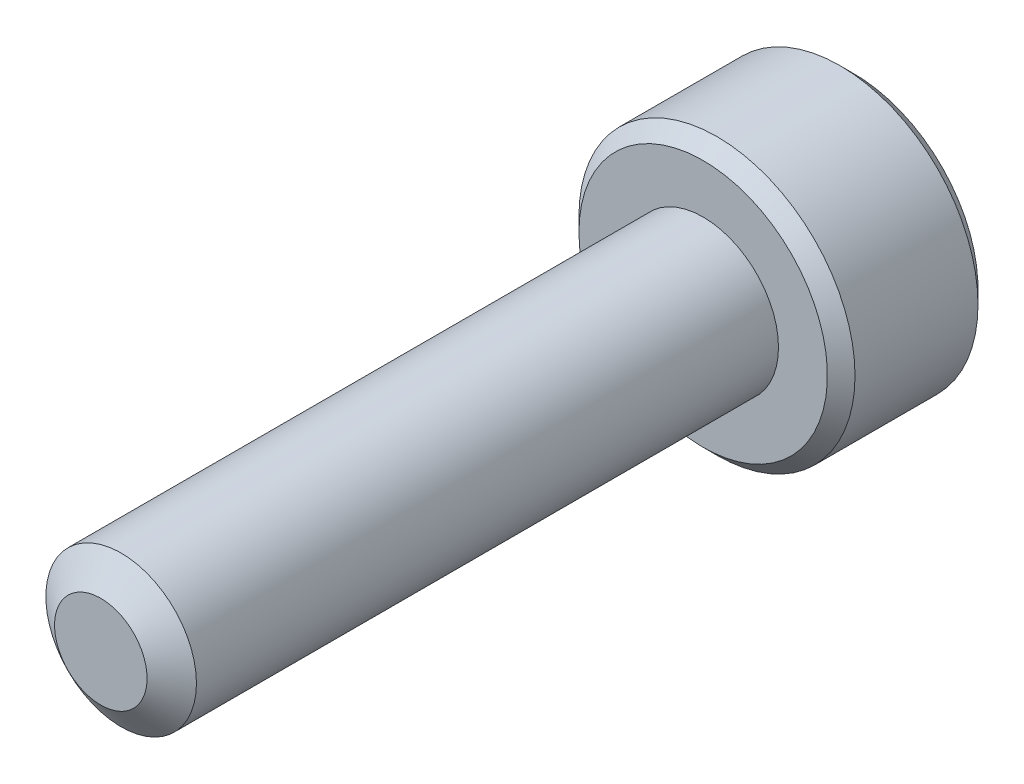
from build123d import *

# Parameters (mm, degrees)
SKETCH1_R          = 1.5
EXTRUDE1_DEPTH     = 12
SKETCH6_R          = 2.75
EXTRUDE2_DEPTH     = 3
CUT_EXTRUDE1_DEPTH = 1.875
CHAMFER1_SIZE      = 0.275


with BuildPart() as part:
    # Sketch1 → Extrude1 (new body)
    with BuildSketch(Plane.XY):
        Circle(SKETCH1_R)
    extrude(amount=-EXTRUDE1_DEPTH)

    # Sketch4 → Cut-Revolve1 (revolve, cut)
    with BuildSketch(Plane(origin=(0, 0, 0), x_dir=(0, 0, -1), z_dir=(1, 0, 0))):
        Polygon((0.405251783, 1.5), (0, 0.921240474), (0, 1.5), align=None)
    revolve(axis=Axis((0, 0, 0), (0, 0, -1)), mode=Mode.SUBTRACT)

    # Sketch6 → Extrude2 (add)
    with BuildSketch(Plane(origin=(0, 0, -12), x_dir=(-1, 0, 0), z_dir=(0, 0, -1))):
        Circle(SKETCH6_R)
    extrude(amount=EXTRUDE2_DEPTH)

    # Sketch7 → Cut-Extrude1 (cut)
    with BuildSketch(Plane(origin=(0, 0, -15), x_dir=(-1, 0, 0), z_dir=(0, 0, -1))):
        Polygon((0, 1.443375673), (-1.25, 0.721687836), (-1.25, -0.721687836), (0, -1.443375673), (1.25, -0.721687836), (1.25, 0.721687836), align=None)
    extrude(amount=-CUT_EXTRUDE1_DEPTH, mode=Mode.SUBTRACT)

    # Chamfer1
    chamfer1_edges = [part.edges().sort_by_distance(p)[0] for p in [
        (2.75, 0, -15),
        (2.75, 0, -12),
    ]]
    chamfer(chamfer1_edges, length=CHAMFER1_SIZE)


solid = part.part
